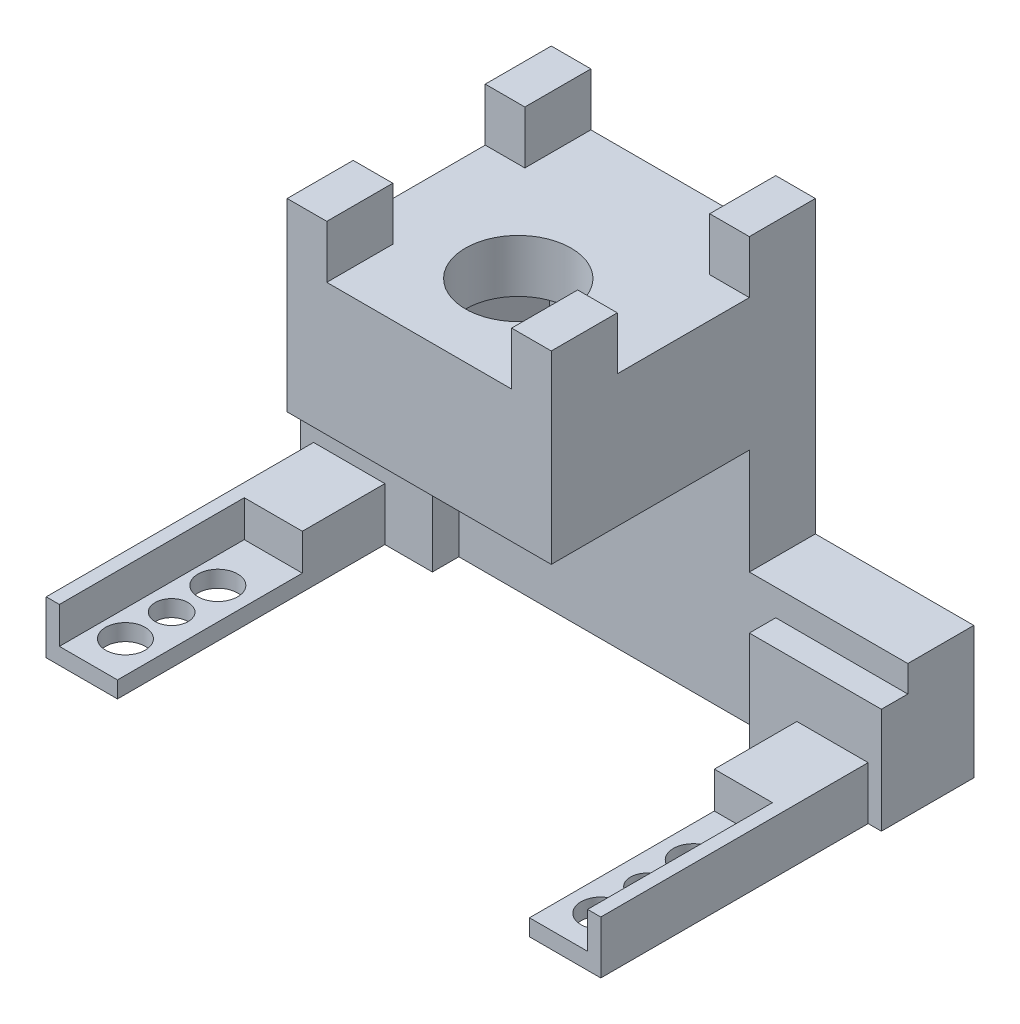
from build123d import *

# Parameters (mm, degrees)
BOSS_EXTRUDE1_DEPTH = 5
SKETCH2_W           = 10
SKETCH2_H           = 8
BOSS_EXTRUDE2_DEPTH = 2
BOSS_EXTRUDE3_DEPTH = 20.25
SKETCH4_R           = 1.25
SKETCH4_R_2         = 1.5
CUT_EXTRUDE1_DEPTH  = 59.259119458
SKETCH6_W           = 4.4
SKETCH6_H           = 2.75
BOSS_EXTRUDE4_DEPTH = 6.25
SKETCH7_W           = 20
SKETCH7_H           = 10
BOSS_EXTRUDE5_DEPTH = 15
CUT_EXTRUDE2_DEPTH  = 6
SKETCH9_R           = 4
CUT_EXTRUDE3_DEPTH  = 58.048772993
SKETCH10_W          = 3
SKETCH10_H          = 5
BOSS_EXTRUDE6_DEPTH = 4


with BuildPart() as part:
    # Sketch1 → Boss-Extrude1 (new body)
    with BuildSketch(Plane.XY):
        Polygon((0, 0), (44, 0), (44, 10), (32, 10), (32, 28), (12, 28), (12, 10), (0, 10), align=None)
    extrude(amount=BOSS_EXTRUDE1_DEPTH)

    # Sketch2 → Boss-Extrude2 (add)
    with BuildSketch(Plane.XY.offset(5)):
        with Locations((39, 4)):
            Rectangle(SKETCH2_W, SKETCH2_H)
        with Locations((5, 4)):
            Rectangle(SKETCH2_W, SKETCH2_H)
    extrude(amount=BOSS_EXTRUDE2_DEPTH)

    # Sketch3 → Boss-Extrude3 (add)
    with BuildSketch(Plane.XY.offset(7)):
        Polygon((37.6, 0), (43, 0), (43, 4), (42, 4), (42, 1.25), (37.6, 1.25), align=None)
        Polygon((1, 0), (6.4, 0), (6.4, 1.25), (2, 1.25), (2, 4), (1, 4), align=None)
    extrude(amount=BOSS_EXTRUDE3_DEPTH)

    # Sketch4 → Cut-Extrude1 (cut, through all)
    with BuildSketch(Plane(origin=(0, 1.25, 0), x_dir=(1, 0, 0), z_dir=(0, 1, 0))):
        with Locations(Location((40, -20.75, 0), (0, 0, 180))):
            Circle(SKETCH4_R)
        with Locations(Location((40, -24.25, 0), (0, 0, 180))):
            Circle(SKETCH4_R_2)
        with Locations(Location((4, -24.25, 0), (0, 0, 180))):
            Circle(SKETCH4_R_2)
        with Locations(Location((4, -17.25, 0), (0, 0, 180))):
            Circle(SKETCH4_R_2)
        with Locations(Location((4, -20.75, 0), (0, 0, 180))):
            Circle(SKETCH4_R)
        with Locations(Location((40, -17.25, 0), (0, 0, 180))):
            Circle(SKETCH4_R_2)
    extrude(amount=-CUT_EXTRUDE1_DEPTH, mode=Mode.SUBTRACT)

    # Sketch6 → Boss-Extrude4 (add)
    with BuildSketch(Plane.XY.offset(7)):
        with Locations((4.2, 2.625)):
            Rectangle(SKETCH6_W, SKETCH6_H)
        with Locations((39.8, 2.625)):
            Rectangle(SKETCH6_W, SKETCH6_H)
    extrude(amount=BOSS_EXTRUDE4_DEPTH)

    # Sketch7 → Boss-Extrude5 (add)
    with BuildSketch(Plane.XY.offset(5)):
        with Locations((22, 23)):
            Rectangle(SKETCH7_W, SKETCH7_H)
    extrude(amount=BOSS_EXTRUDE5_DEPTH)

    # Sketch8 → Cut-Extrude2 (cut)
    with BuildSketch(Plane.XZ.offset(-18)):
        Polygon((28.495190528, 12.5), (25.247595264, 18.125), (18.752404736, 18.125), (15.504809472, 12.5), (18.752404736, 6.875), (25.247595264, 6.875), align=None)
    extrude(amount=-CUT_EXTRUDE2_DEPTH, mode=Mode.SUBTRACT)

    # Sketch9 → Cut-Extrude3 (cut, through all)
    with BuildSketch(Plane.XZ.offset(-24)):
        with Locations(Location((22, 12.5, 0), (0, 0, 270))):
            Circle(SKETCH9_R)
    extrude(amount=-CUT_EXTRUDE3_DEPTH, mode=Mode.SUBTRACT)

    # Sketch10 → Boss-Extrude6 (add)
    with BuildSketch(Plane(origin=(0, 28, 0), x_dir=(1, 0, 0), z_dir=(0, 1, 0))):
        with Locations((30.5, -2.5)):
            Rectangle(SKETCH10_W, SKETCH10_H)
        with Locations((30.5, -17.5)):
            Rectangle(SKETCH10_W, SKETCH10_H)
        with Locations((13.5, -2.5)):
            Rectangle(SKETCH10_W, SKETCH10_H)
        with Locations((13.5, -17.5)):
            Rectangle(SKETCH10_W, SKETCH10_H)
    extrude(amount=BOSS_EXTRUDE6_DEPTH)


solid = part.part
